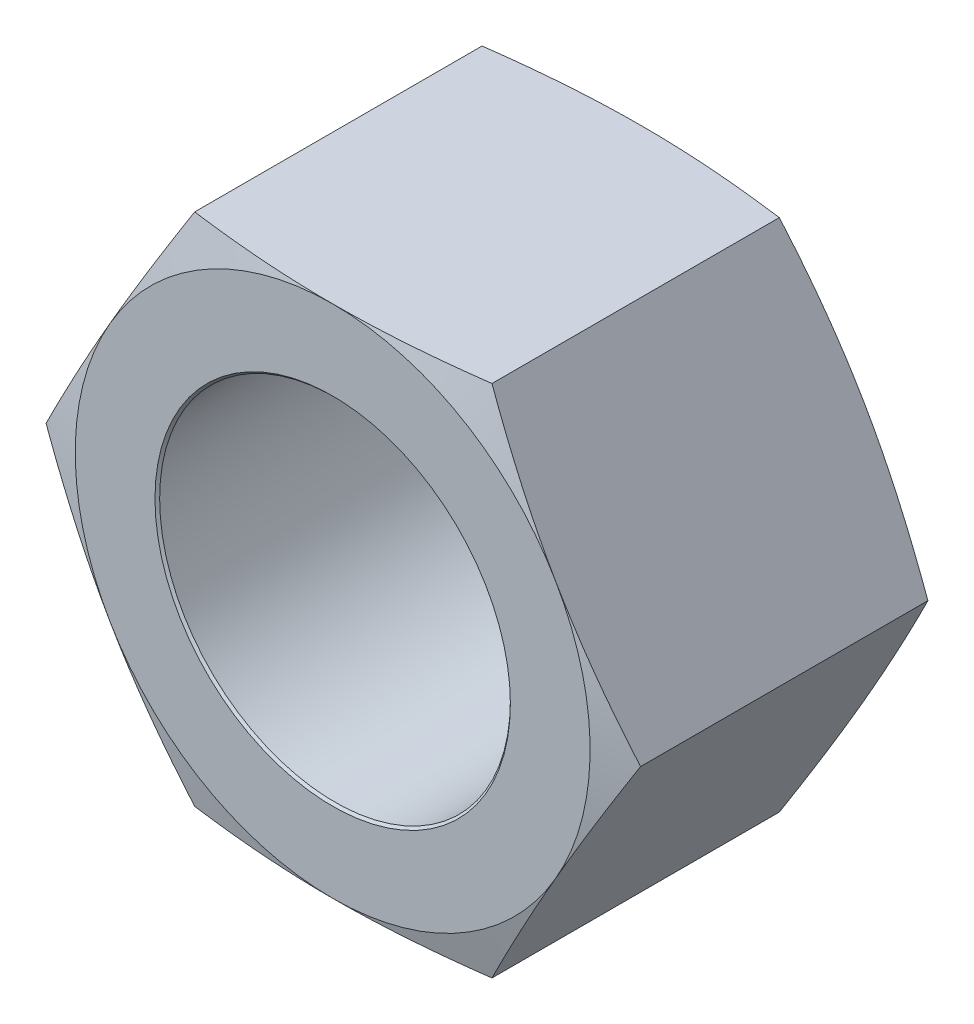
from build123d import *

# Parameters (mm, degrees)
SKETCH_1_R          = 15
EXTRUDE_589_DEPTH   = 26.4
SKETCH_2_OUTSIDE_W  = 350.938
SKETCH_2_OUTSIDE_H  = 344.126
SKETCH_2_OUTSIDE_R  = 22.018695891
CUT_EXTRUDE_1_DEPTH = 38
CUT_EXTRUDE_1_DRAFT = -75
SKETCH_3_OUTSIDE_W  = 350.938
SKETCH_3_OUTSIDE_H  = 344.126
SKETCH_3_OUTSIDE_R  = 22.018695891
CUT_EXTRUDE_2_DEPTH = 38
CUT_EXTRUDE_2_DRAFT = -75
CHAMFER_1_SIZE      = 0.2


with BuildPart() as part:
    # 草图1 → Extrude 589 (new body)
    with BuildSketch(Plane.XY):
        Polygon((12.7125, 22.018695891), (-12.7125, 22.018695891), (-25.425, 0), (-12.7125, -22.018695891), (12.7125, -22.018695891), (25.425, 0), align=None)
        Circle(SKETCH_1_R, mode=Mode.SUBTRACT)
    extrude(amount=EXTRUDE_589_DEPTH)


with BuildPart() as cut_extrude_1_tool:
    # 草图2 outside → 切除-拉伸1 (with draft: the straight prism first)
    with BuildSketch(Plane(origin=(0, 0, 0), x_dir=(-1, 0, 0), z_dir=(0, 0, -1))):
        Rectangle(SKETCH_2_OUTSIDE_W, SKETCH_2_OUTSIDE_H)
        Circle(SKETCH_2_OUTSIDE_R, mode=Mode.SUBTRACT)
    extrude(amount=-CUT_EXTRUDE_1_DEPTH)
    # 切除-拉伸1: the draft: its side faces are tilted about the plane it starts from
    cut_extrude_1_sides = [cut_extrude_1_tool.faces().sort_by_distance(p)[0] for p in [
        (0, -172.063, 19),
        (-175.469, 0, 19),
        (0, 172.063, 19),
        (175.469, 0, 19),
        (22.018695891, 0, 19),
    ]]
    draft(cut_extrude_1_sides, Plane(origin=(0, 0, 0), x_dir=(-1, 0, 0), z_dir=(0, 0, -1)), CUT_EXTRUDE_1_DRAFT)


with BuildPart() as part_1:
    add(part.part)

    # 切除-拉伸1: cut by cut_extrude_1_tool
    add(cut_extrude_1_tool.part, mode=Mode.SUBTRACT)


with BuildPart() as cut_extrude_2_tool:
    # 草图3 outside → 切除-拉伸2 (with draft: the straight prism first)
    with BuildSketch(Plane.XY.offset(26.4)):
        Rectangle(SKETCH_3_OUTSIDE_W, SKETCH_3_OUTSIDE_H)
        Circle(SKETCH_3_OUTSIDE_R, mode=Mode.SUBTRACT)
    extrude(amount=-CUT_EXTRUDE_2_DEPTH)
    # 切除-拉伸2: the draft: its side faces are tilted about the plane it starts from
    cut_extrude_2_sides = [cut_extrude_2_tool.faces().sort_by_distance(p)[0] for p in [
        (0, -172.063, 7.4),
        (175.469, 0, 7.4),
        (0, 172.063, 7.4),
        (-175.469, 0, 7.4),
        (-22.018695891, 0, 7.4),
    ]]
    draft(cut_extrude_2_sides, Plane.XY.offset(26.4), CUT_EXTRUDE_2_DRAFT)


with BuildPart() as part_2:
    add(part_1.part)

    # 切除-拉伸2: cut by cut_extrude_2_tool
    add(cut_extrude_2_tool.part, mode=Mode.SUBTRACT)

    # 倒角1
    chamfer_1_edges = [part_2.edges().sort_by_distance(p)[0] for p in [
        (-15, 0, 0),
        (-15, 0, 26.4),
    ]]
    chamfer(chamfer_1_edges, length=CHAMFER_1_SIZE)


solid = part_2.part
